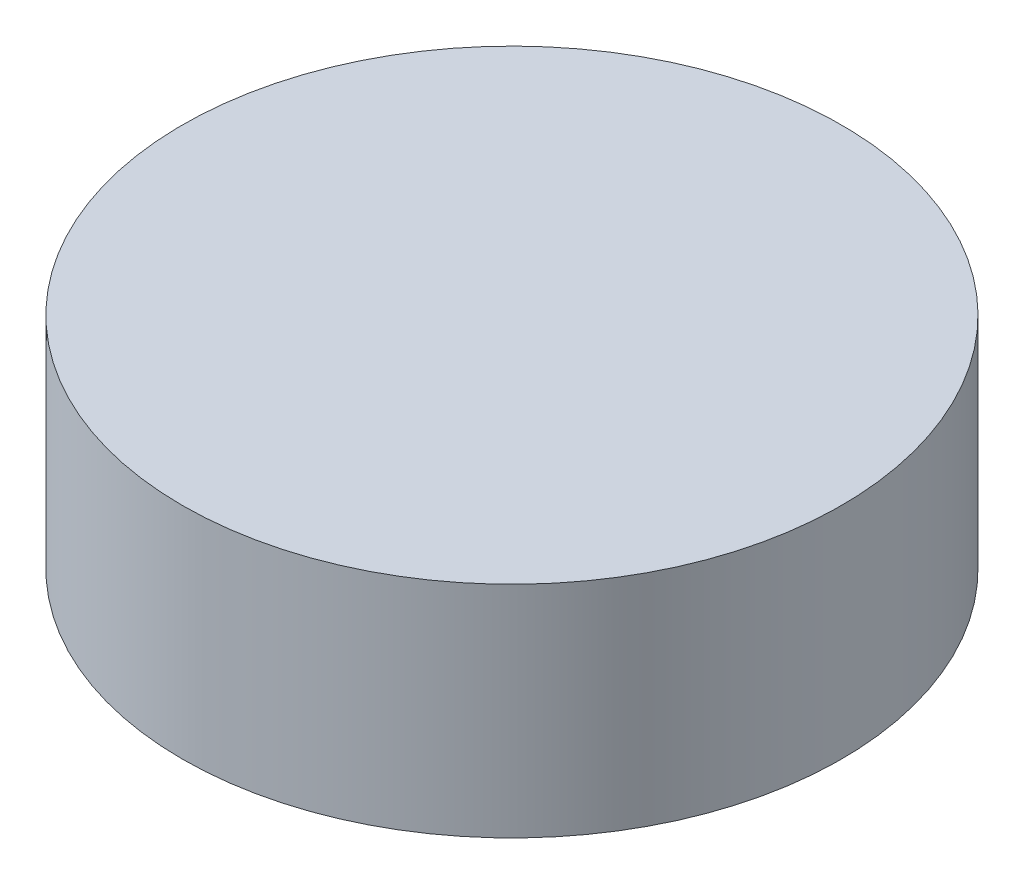
from build123d import *

# Parameters (mm, degrees)
SKETCH1_R           = 4.7625
BOSS_EXTRUDE1_DEPTH = 3.175


with BuildPart() as part:
    # Sketch1 → Boss-Extrude1 (new body)
    with BuildSketch(Plane(origin=(0, 0, 0), x_dir=(1, 0, 0), z_dir=(0, 1, 0))):
        with Locations(Location((0, 0, 0), (0, 0, 270))):
            Circle(SKETCH1_R)
    extrude(amount=BOSS_EXTRUDE1_DEPTH)


solid = part.part
